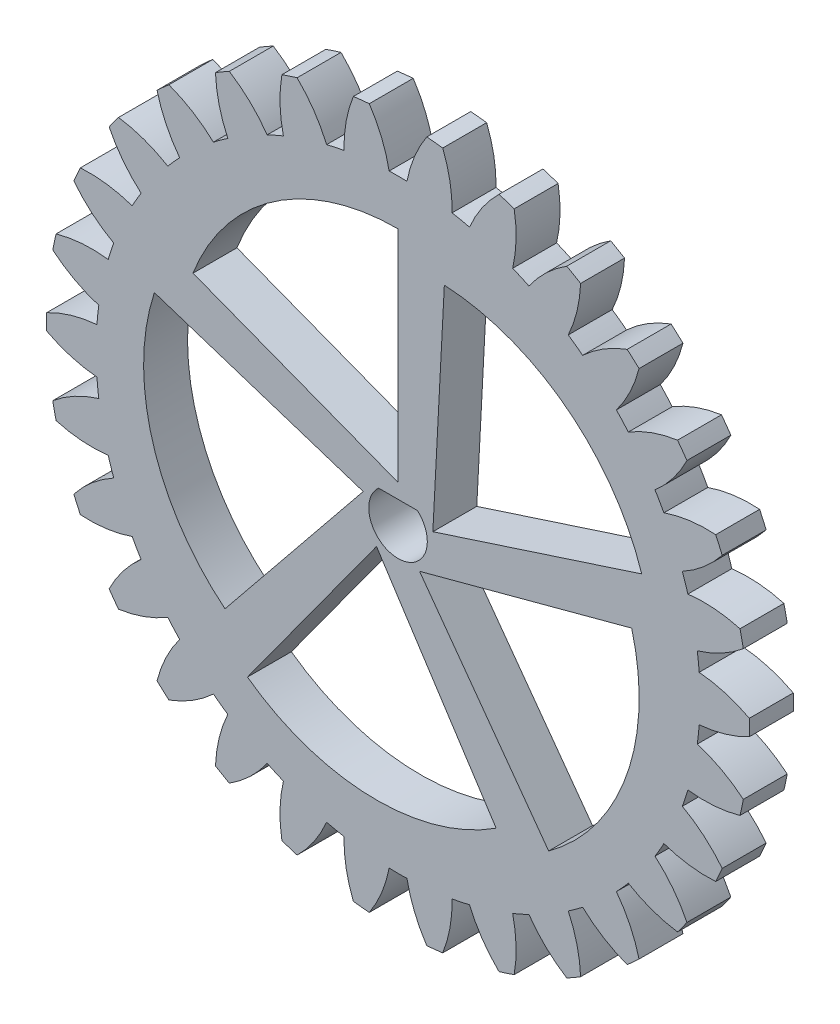
from build123d import *

# Parameters (mm, degrees)
SKETCH1_R           = 24
BOSS_EXTRUDE1_DEPTH = 3
CUT_EXTRUDE2_DEPTH  = 5
CIRPATTERN1_COUNT   = 30
CUT_EXTRUDE4_DEPTH  = 10
CIRPATTERN3_COUNT   = 5
CUT_EXTRUDE5_DEPTH  = 8


with BuildPart() as part:
    # Sketch1 → Boss-Extrude1 (new body)
    with BuildSketch(Plane.XY):
        Circle(SKETCH1_R)
    extrude(amount=BOSS_EXTRUDE1_DEPTH)

    # Sketch2 → Cut-Extrude2 (cut)
    with BuildSketch(Plane(origin=(0, 0, 0), x_dir=(-1, 0, 0), z_dir=(0, 0, -1))):
        with BuildLine():
            ThreePointArc((0.607894329, 20.616039617), (0, 20.625), (-0.607894329, 20.616039617))
            ThreePointArc((-0.607894329, 20.616039617), (-1.120930048, 22.335720311), (-1.964958318, 23.919425972))
            ThreePointArc((-1.964958318, 23.919425972), (0, 24), (1.964958318, 23.919425972))
            ThreePointArc((1.964958318, 23.919425972), (1.120930048, 22.335720311), (0.607894329, 20.616039617))
        make_face()
    cut_extrude2 = extrude(amount=-CUT_EXTRUDE2_DEPTH, mode=Mode.SUBTRACT)

    # CirPattern1: Cut-Extrude2 ×30 about axis
    cirpattern1_axis = Axis((0, 0, 0), (0, 0, 1))
    for i in range(1, CIRPATTERN1_COUNT):
        add(cut_extrude2.rotate(cirpattern1_axis, i * 360 / CIRPATTERN1_COUNT), mode=Mode.SUBTRACT)

    # Sketch3 → Cut-Extrude4 (cut)
    with BuildSketch(Plane(origin=(0, 0, 0), x_dir=(-1, 0, 0), z_dir=(0, 0, -1))):
        with BuildLine():
            Line((14.003706397, 7.875519243), (0, 2.5))
            Line((0, 2.5), (0, 17.5))
            ThreePointArc((0, 17.5), (8.496093554, 14.861892829), (14.003706397, 7.875519243))
        make_face()
    cut_extrude4 = extrude(amount=-CUT_EXTRUDE4_DEPTH, mode=Mode.SUBTRACT)

    # CirPattern3: Cut-Extrude4 ×5 about axis
    cirpattern3_axis = Axis((0, 0, 0), (0, 0, 1))
    for i in range(1, CIRPATTERN3_COUNT):
        add(cut_extrude4.rotate(cirpattern3_axis, i * 360 / CIRPATTERN3_COUNT), mode=Mode.SUBTRACT)

    # Sketch4 → Cut-Extrude5 (cut)
    with BuildSketch(Plane.XY.offset(3)):
        with BuildLine():
            Line((-1.322875656, 1.5), (1.322875656, 1.5))
            ThreePointArc((1.322875656, 1.5), (0, -2), (-1.322875656, 1.5))
        make_face()
    extrude(amount=-CUT_EXTRUDE5_DEPTH, mode=Mode.SUBTRACT)


solid = part.part
